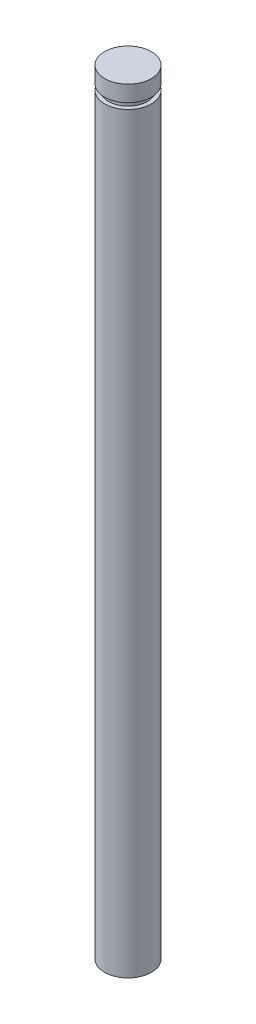
from build123d import *


with BuildPart() as part:
    # Sketch1 → Revolve1 (revolve)
    with BuildSketch(Plane.XY, mode=Mode.PRIVATE) as revolve1_sk:
        Polygon((0, 0), (0.725, 0), (0.725, 23.32), (0.6, 23.32), (0.6, 23.5), (0.725, 23.5), (0.725, 24), (0, 24), align=None)
    revolve(revolve1_sk.sketch.rotate(Axis((0, 24, 0), (0, -1, 0)), 180), axis=Axis((0, 24, 0), (0, -1, 0)))


solid = part.part
